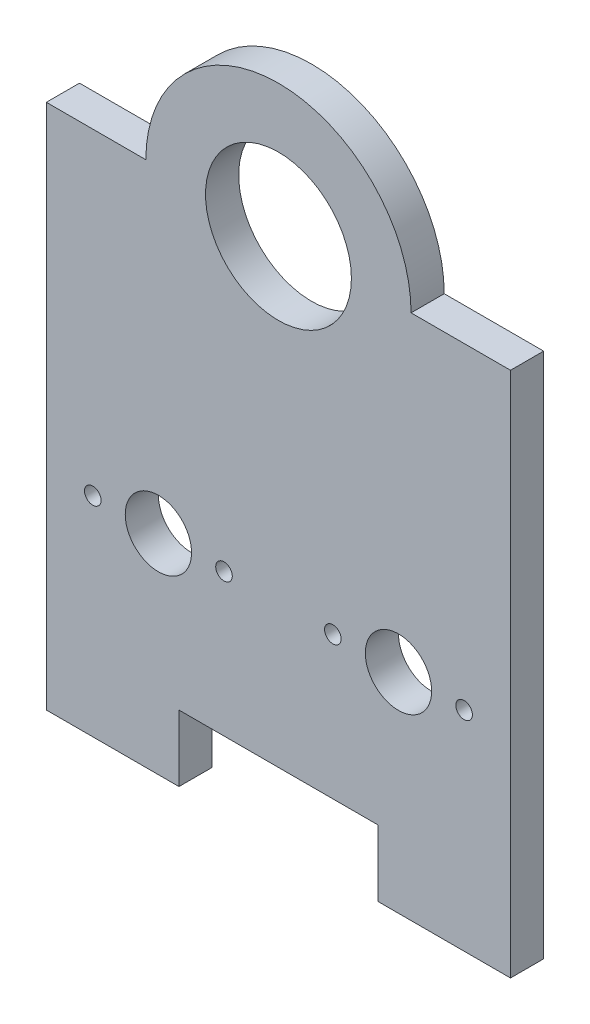
from build123d import *

# Parameters (mm, degrees)
SKETCH1_R           = 11
SKETCH1_R_2         = 1.25
SKETCH1_R_3         = 5
BOSS_EXTRUDE7_DEPTH = 5


with BuildPart() as part:
    # Sketch1 → Boss-Extrude7 (new body)
    with BuildSketch(Plane.XY):
        with BuildLine():
            Line((-16.905, 47.876904679), (-1.9, 47.876904679))
            ThreePointArc((-1.9, 47.876904679), (18.1, 67.876904679), (38.1, 47.876904679))
            Line((38.1, 47.876904679), (53.095, 47.876904679))
            Line((53.095, 47.876904679), (53.095, -21.5))
            Line((53.095, -21.5), (53.095, -31.5))
            Line((53.095, -31.5), (33.095, -31.5))
            Line((33.095, -31.5), (33.095, -21.5))
            Line((33.095, -21.5), (3.095, -21.5))
            Line((3.095, -21.5), (3.095, -31.5))
            Line((3.095, -31.5), (-16.905, -31.5))
            Line((-16.905, -31.5), (-16.905, -21.5))
            Line((-16.905, -21.5), (-16.905, 47.876904679))
        make_face()
        with Locations((18.1, 47.876904679)):
            Circle(SKETCH1_R, mode=Mode.SUBTRACT)
        with Locations((46.095, 0)):
            Circle(SKETCH1_R_2, mode=Mode.SUBTRACT)
        with Locations((36.2, 0)):
            Circle(SKETCH1_R_3, mode=Mode.SUBTRACT)
        with Locations((26.305, 0)):
            Circle(SKETCH1_R_2, mode=Mode.SUBTRACT)
        with Locations(Location((-9.901900695, 0.004035702, 0), (0, 0, 180))):
            Circle(SKETCH1_R_2, mode=Mode.SUBTRACT)
        with Locations(Location((9.888099099, 0.001183168, 0), (0, 0, 180))):
            Circle(SKETCH1_R_2, mode=Mode.SUBTRACT)
        with Locations(Location((-0.006900798, 0.002609435, 0), (0, 0, 180))):
            Circle(SKETCH1_R_3, mode=Mode.SUBTRACT)
    extrude(amount=BOSS_EXTRUDE7_DEPTH)


solid = part.part
